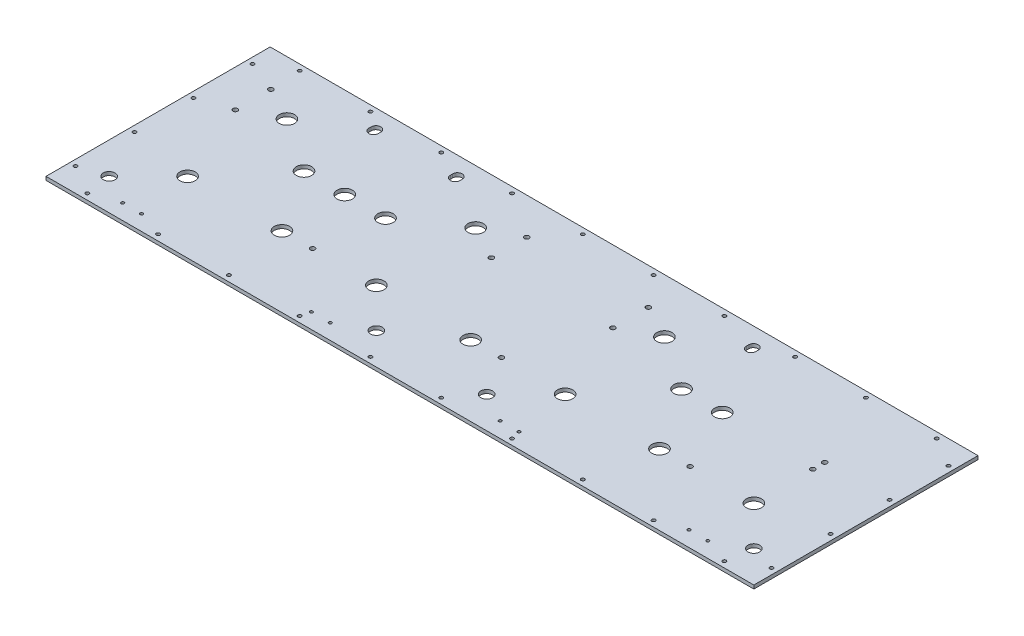
from build123d import *

# Parameters (mm, degrees)
SKETCH1_W           = 600
SKETCH1_H           = 190
EXTRUDE1_DEPTH      = 3
SKETCH2_R           = 6.5
CUT_EXTRUDE1_DEPTH  = 614.929149007
SKETCH5_R           = 2
CUT_EXTRUDE3_DEPTH  = 614.929149007
SKETCH8_R           = 6.5
SKETCH8_R_2         = 2
CUT_EXTRUDE4_DEPTH  = 614.929149007
SKETCH10_R          = 6.5
CUT_EXTRUDE5_DEPTH  = 614.929149007
SKETCH12_R          = 6.5
CUT_EXTRUDE6_DEPTH  = 614.929149007
SKETCH14_R          = 1.25
CUT_EXTRUDE7_DEPTH  = 614.929149007
SKETCH15_R          = 5
CUT_EXTRUDE8_DEPTH  = 614.929149007
CUT_EXTRUDE10_DEPTH = 614.929149007
SKETCH25_R          = 1.5
CUT_EXTRUDE11_DEPTH = 614.929149007
LPATTERN1_COUNT     = 10
LPATTERN1_PITCH     = 60
SKETCH26_R          = 1.5
CUT_EXTRUDE12_DEPTH = 614.929149007
SKETCH27_R          = 2
CUT_EXTRUDE13_DEPTH = 614.929149007


with BuildPart() as part:
    # Sketch1 → Extrude1 (new body)
    with BuildSketch(Plane(origin=(0, 0, 0), x_dir=(1, 0, 0), z_dir=(0, 1, 0))):
        with Locations((300, 35)):
            Rectangle(SKETCH1_W, SKETCH1_H)
    extrude(amount=EXTRUDE1_DEPTH)

    # Sketch2 → Cut-Extrude1 (cut, through all)
    with BuildSketch(Plane(origin=(0, 3, 0), x_dir=(-1, 0, 0), z_dir=(0, 1, 0))):
        with Locations((-60, 0)):
            Circle(SKETCH2_R)
        with Locations((-140, 0)):
            Circle(SKETCH2_R)
        with Locations((-220, 0)):
            Circle(SKETCH2_R)
        with Locations((-300, 0)):
            Circle(SKETCH2_R)
        with Locations((-380, 0)):
            Circle(SKETCH2_R)
        with Locations((-460, 0)):
            Circle(SKETCH2_R)
        with Locations((-540, 0)):
            Circle(SKETCH2_R)
    extrude(amount=-CUT_EXTRUDE1_DEPTH, mode=Mode.SUBTRACT)

    # Sketch5 → Cut-Extrude3 (cut, through all)
    with BuildSketch(Plane(origin=(0, 3, 0), x_dir=(-1, 0, 0), z_dir=(0, 1, 0))):
        with Locations((-166, 0)):
            Circle(SKETCH5_R)
        with Locations((-326, 0)):
            Circle(SKETCH5_R)
        with Locations((-486, 0)):
            Circle(SKETCH5_R)
    extrude(amount=-CUT_EXTRUDE3_DEPTH, mode=Mode.SUBTRACT)

    # Sketch8 → Cut-Extrude4 (cut, through all)
    with BuildSketch(Plane(origin=(0, 3, 0), x_dir=(-1, 0, 0), z_dir=(0, 1, 0))):
        with Locations((-105.461363383, -53.228417592)):
            Circle(SKETCH8_R)
        with Locations((-540, -60)):
            Circle(SKETCH8_R_2)
        with Locations((-425.461363383, -53.228417592)):
            Circle(SKETCH8_R)
        with Locations((-174.538636617, -53.228417592)):
            Circle(SKETCH8_R)
        with Locations((-540, -50)):
            Circle(SKETCH8_R_2)
    extrude(amount=-CUT_EXTRUDE4_DEPTH, mode=Mode.SUBTRACT)

    # Sketch10 → Cut-Extrude5 (cut, through all)
    with BuildSketch(Plane(origin=(0, 3, 0), x_dir=(-1, 0, 0), z_dir=(0, 1, 0))):
        with Locations((-60, -84.184264202)):
            Circle(SKETCH10_R)
        with Locations((-220, -84.184264202)):
            Circle(SKETCH10_R)
        with Locations((-380, -84.184264202)):
            Circle(SKETCH10_R)
    extrude(amount=-CUT_EXTRUDE5_DEPTH, mode=Mode.SUBTRACT)

    # Sketch12 → Cut-Extrude6 (cut, through all)
    with BuildSketch(Plane(origin=(0, 3, 0), x_dir=(-1, 0, 0), z_dir=(0, 1, 0))):
        with Locations((-140, -53.228417592)):
            Circle(SKETCH12_R)
        with Locations((-460, -53.228417592)):
            Circle(SKETCH12_R)
    extrude(amount=-CUT_EXTRUDE6_DEPTH, mode=Mode.SUBTRACT)

    # Sketch14 → Cut-Extrude7 (cut, through all)
    with BuildSketch(Plane(origin=(0, 3, 0), x_dir=(-1, 0, 0), z_dir=(0, 1, 0))):
        with Locations((-52, 47)):
            Circle(SKETCH14_R)
        with Locations((-68, 47)):
            Circle(SKETCH14_R)
        with Locations((-212, 47)):
            Circle(SKETCH14_R)
        with Locations((-228, 47)):
            Circle(SKETCH14_R)
        with Locations((-372, 47)):
            Circle(SKETCH14_R)
        with Locations((-388, 47)):
            Circle(SKETCH14_R)
        with Locations((-532, 47)):
            Circle(SKETCH14_R)
        with Locations((-548, 47)):
            Circle(SKETCH14_R)
    extrude(amount=-CUT_EXTRUDE7_DEPTH, mode=Mode.SUBTRACT)

    # Sketch15 → Cut-Extrude8 (cut, through all)
    with BuildSketch(Plane(origin=(0, 3, 0), x_dir=(-1, 0, 0), z_dir=(0, 1, 0))):
        with Locations((-573.234018716, 33.234018716)):
            Circle(SKETCH15_R)
        with Locations((-26.765981284, 33.234018716)):
            Circle(SKETCH15_R)
        with Locations((-253.234018716, 33.234018716)):
            Circle(SKETCH15_R)
        with Locations((-346.765981284, 33.234018716)):
            Circle(SKETCH15_R)
    extrude(amount=-CUT_EXTRUDE8_DEPTH, mode=Mode.SUBTRACT)

    # Sketch23 → Cut-Extrude10 (cut, through all)
    with BuildSketch(Plane(origin=(0, 3, 0), x_dir=(-1, 0, 0), z_dir=(0, 1, 0))):
        with BuildLine():
            Line((-101.461363383, -112.228417592), (-101.461363383, -114.228417592))
            ThreePointArc((-101.461363383, -114.228417592), (-105.461363383, -118.228417592), (-109.461363383, -114.228417592))
            Line((-109.461363383, -114.228417592), (-109.461363383, -112.228417592))
            ThreePointArc((-109.461363383, -112.228417592), (-105.461363383, -108.228417592), (-101.461363383, -112.228417592))
        make_face()
        with BuildLine():
            Line((-170.538636617, -112.228417592), (-170.538636617, -114.228417592))
            ThreePointArc((-170.538636617, -114.228417592), (-174.538636617, -118.228417592), (-178.538636617, -114.228417592))
            Line((-178.538636617, -114.228417592), (-178.538636617, -112.228417592))
            ThreePointArc((-178.538636617, -112.228417592), (-174.538636617, -108.228417592), (-170.538636617, -112.228417592))
        make_face()
        with BuildLine():
            Line((-421.461363383, -112.228417592), (-421.461363383, -114.228417592))
            ThreePointArc((-421.461363383, -114.228417592), (-425.461363383, -118.228417592), (-429.461363383, -114.228417592))
            Line((-429.461363383, -114.228417592), (-429.461363383, -112.228417592))
            ThreePointArc((-429.461363383, -112.228417592), (-425.461363383, -108.228417592), (-421.461363383, -112.228417592))
        make_face()
    extrude(amount=-CUT_EXTRUDE10_DEPTH, mode=Mode.SUBTRACT)

    # Sketch25 → Cut-Extrude11 (cut, through all)
    with BuildSketch(Plane(origin=(0, 3, 0), x_dir=(-1, 0, 0), z_dir=(0, 1, 0))):
        with Locations((-30, 55)):
            Circle(SKETCH25_R)
        with Locations((-30, -125)):
            Circle(SKETCH25_R)
    cut_extrude11 = extrude(amount=-CUT_EXTRUDE11_DEPTH, mode=Mode.SUBTRACT)

    # LPattern1: Cut-Extrude11 ×10
    with Locations(*[(i * LPATTERN1_PITCH, 0, 0) for i in range(1, LPATTERN1_COUNT)]):
        add(cut_extrude11, mode=Mode.SUBTRACT)

    # Sketch26 → Cut-Extrude12 (cut, through all)
    with BuildSketch(Plane(origin=(0, 3, 0), x_dir=(-1, 0, 0), z_dir=(0, 1, 0))):
        with Locations((-5, -110)):
            Circle(SKETCH26_R)
        with Locations((-5, -60)):
            Circle(SKETCH26_R)
        with Locations((-5, 40)):
            Circle(SKETCH26_R)
        with Locations((-5, -10)):
            Circle(SKETCH26_R)
        with Locations((-595, -110)):
            Circle(SKETCH26_R)
        with Locations((-595, -60)):
            Circle(SKETCH26_R)
        with Locations((-595, -10)):
            Circle(SKETCH26_R)
        with Locations((-595, 40)):
            Circle(SKETCH26_R)
    extrude(amount=-CUT_EXTRUDE12_DEPTH, mode=Mode.SUBTRACT)

    # Sketch27 → Cut-Extrude13 (cut, through all)
    with BuildSketch(Plane(origin=(0, 3, 0), x_dir=(-1, 0, 0), z_dir=(0, 1, 0))):
        with Locations((-351.5, -99.041033847)):
            Circle(SKETCH27_R)
        with Locations((-351.5, -69.041033847)):
            Circle(SKETCH27_R)
        with Locations((-248.5, -99.041033847)):
            Circle(SKETCH27_R)
        with Locations((-248.5, -69.041033847)):
            Circle(SKETCH27_R)
        with Locations((-31.498394821, -99.041033847)):
            Circle(SKETCH27_R)
        with Locations((-31.498394821, -69.041033847)):
            Circle(SKETCH27_R)
    extrude(amount=-CUT_EXTRUDE13_DEPTH, mode=Mode.SUBTRACT)


solid = part.part
